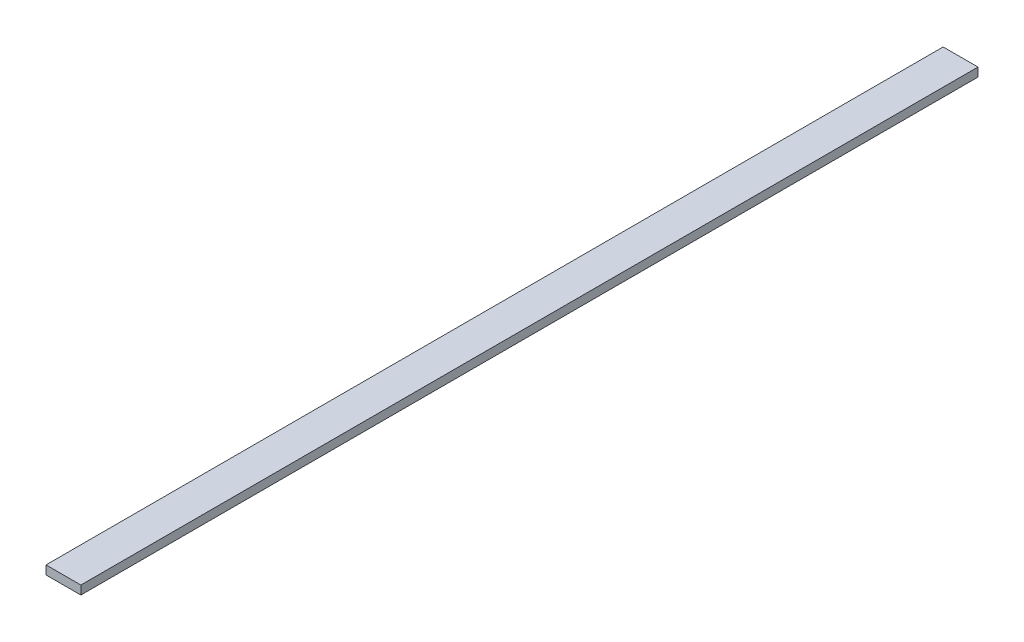
from build123d import *

# Parameters (mm, degrees)
SKETCH_1_W      = 200
SKETCH_1_H      = 50
EXTRUDE_1_DEPTH = 5150


with BuildPart() as part:
    # Эскиз1 → Бобышка-Вытянуть1 (new body)
    with BuildSketch(Plane.XY):
        with Locations((-100, 25)):
            Rectangle(SKETCH_1_W, SKETCH_1_H)
    extrude(amount=-EXTRUDE_1_DEPTH)


solid = part.part
